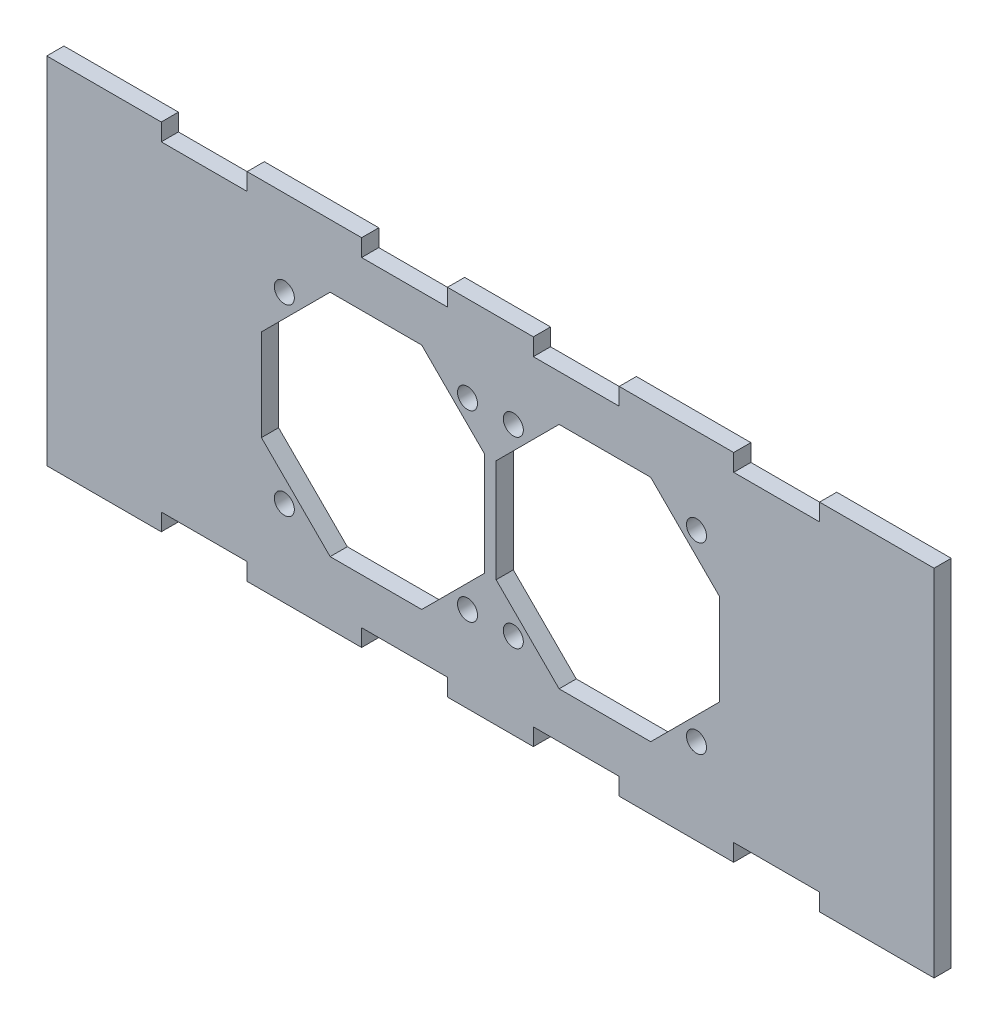
from build123d import *

# Parameters (mm, degrees)
SKICA1_R                = 1.75
P_IDAT_VYSUNUT_M1_DEPTH = 3


with BuildPart() as part:
    # Skica1 → Přidat vysunutím1 (new body)
    with BuildSketch(Plane.XY):
        Polygon((20, 3), (35, 3), (35, 0), (55, 0), (55, 3), (70, 3), (70, 0), (77.5, 0), (77.5, 11), (77.5, 20.346281592), (77.5, 41.653718408), (77.5, 51), (77.5, 62), (70, 62), (70, 59), (55, 59), (55, 62), (35, 62), (35, 59), (20, 59), (20, 62), (0, 62), (0, 0), (20, 0), align=None)
        with Locations((41.5, 47)):
            Circle(SKICA1_R, mode=Mode.SUBTRACT)
        with Locations(Location((41.5, 15, 0), (0, 0, 180))):
            Circle(SKICA1_R, mode=Mode.SUBTRACT)
        with Locations((73.5, 15)):
            Circle(SKICA1_R, mode=Mode.SUBTRACT)
        with Locations(Location((73.5, 47, 0), (0, 0, 180))):
            Circle(SKICA1_R, mode=Mode.SUBTRACT)
        Polygon((65.5, 51), (49.5, 51), (37.5, 39), (37.5, 23), (49.5, 11), (65.5, 11), (76.500000683, 22.000000683), (76.500000683, 39.999999317), align=None, mode=Mode.SUBTRACT)
    p_idat_vysunut_m1 = extrude(amount=P_IDAT_VYSUNUT_M1_DEPTH)

    # Zrcadlit1: Přidat vysunutím1 across plane
    add(p_idat_vysunut_m1.mirror(Plane(origin=(77.5, 51, 3), x_dir=(0, 0, 1), z_dir=(-1, 0, 0))))


solid = part.part
